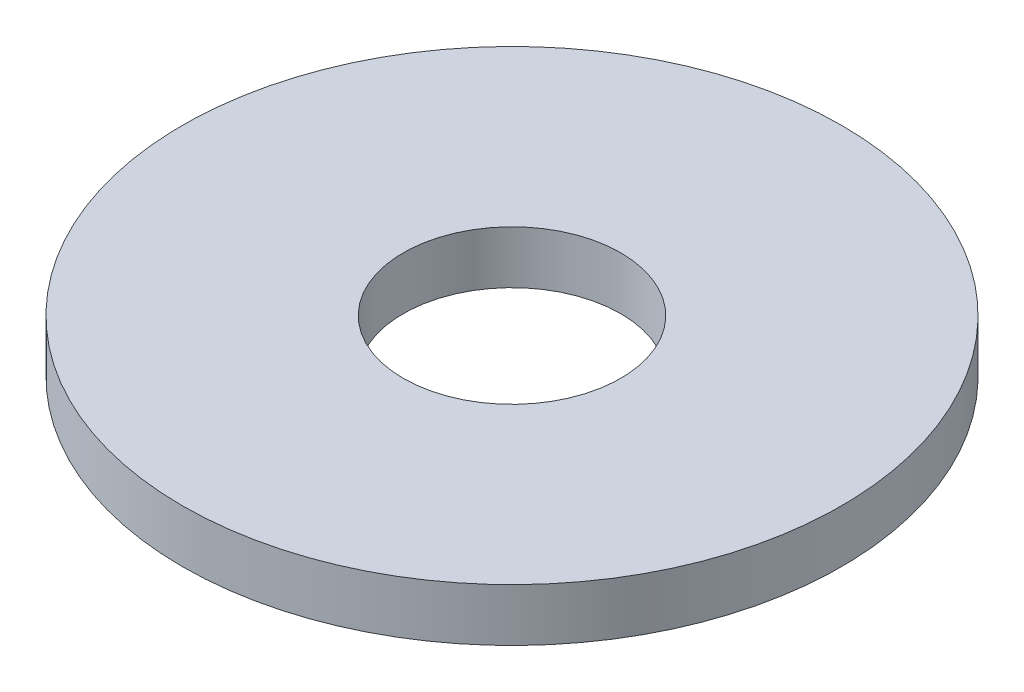
from build123d import *

# Parameters (mm, degrees)
SKETCH_1_R      = 25
SKETCH_1_R_2    = 8.25
EXTRUDE_1_DEPTH = 4


with BuildPart() as part:
    # Эскиз1 → Бобышка-Вытянуть1 (new body)
    with BuildSketch(Plane(origin=(0, 0, 0), x_dir=(1, 0, 0), z_dir=(0, 1, 0))):
        with Locations(Location((0, 0, 0), (0, 0, 270))):
            Circle(SKETCH_1_R)
        with Locations(Location((0, 0, 0), (0, 0, 270))):
            Circle(SKETCH_1_R_2, mode=Mode.SUBTRACT)
    extrude(amount=EXTRUDE_1_DEPTH)


solid = part.part
